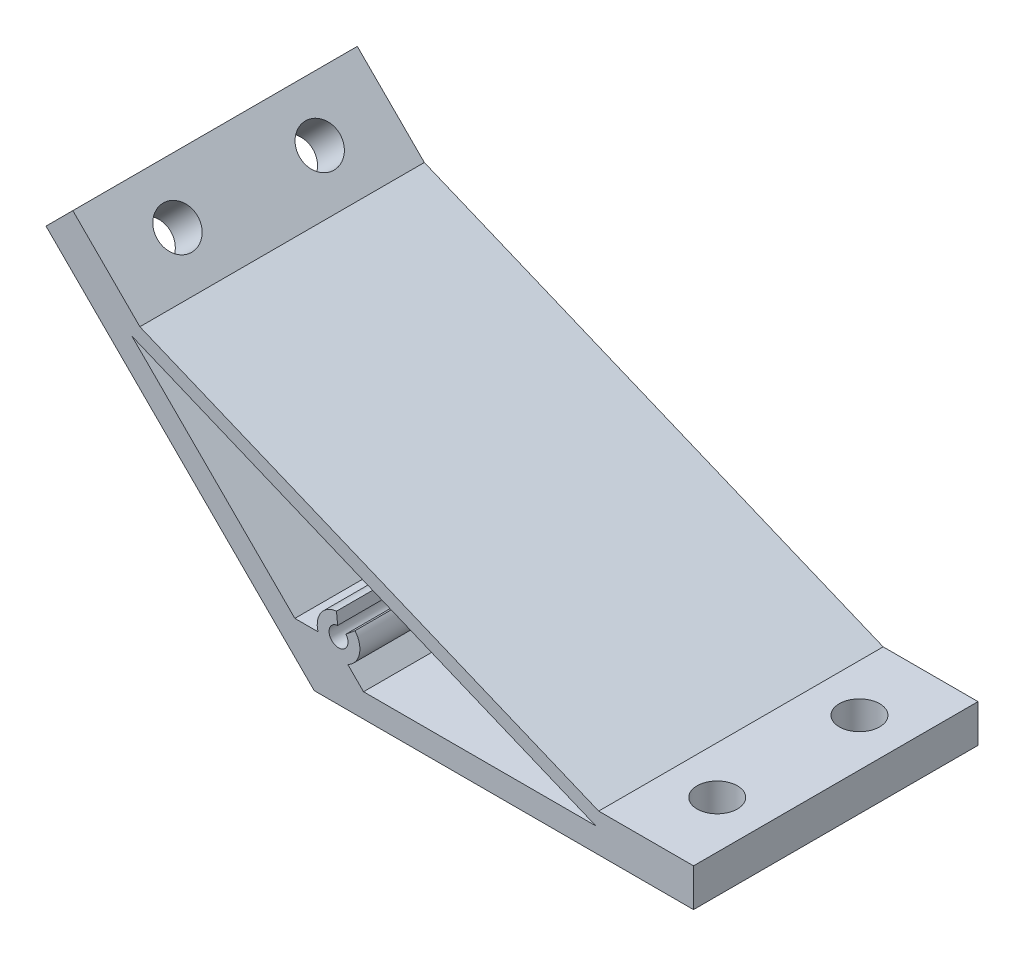
from build123d import *

# Parameters (mm, degrees)
EXTRUDE_1_DEPTH         = 30
HOLE_WIZARD_8_5_8_5_1_D = 8.5
HOLE_WIZARD_8_5_8_5_2_D = 8.5


with BuildPart() as part:
    # 草图1 → 凸台-拉伸1 (new, symmetric)
    with BuildSketch(Plane.XY):
        Polygon((6936.119122288, -1232.086390659), (6992.687664783, -1288.654933154), (7072.687664783, -1288.654933154), (7072.687664783, -1280.654933154), (7052.687664783, -1280.654933154), (6955.918112162, -1240.571672033), (6941.775976538, -1226.429536409), align=None)
        with BuildLine():
            Line((7009.090927681, -1283.654933154), (7003.090927681, -1283.654933154))
            Line((7003.090927681, -1283.654933154), (6999.760549745, -1280.324555218))
            ThreePointArc((6999.760549745, -1280.324555218), (7002.213755914, -1277.239517812), (7001.296666197, -1273.406161221))
            Line((7001.296666197, -1273.406161221), (6999.365595427, -1274.993916141))
            ThreePointArc((6999.365595427, -1274.993916141), (6997.055371947, -1278.111879141), (6997.626530039, -1274.273571671))
            Line((6997.626530039, -1274.273571671), (6997.383769074, -1271.785386165))
            ThreePointArc((6997.383769074, -1271.785386165), (6994.101203016, -1273.731324494), (6993.49338103, -1277.49861375))
            Line((6993.49338103, -1277.49861375), (6988.602413191, -1277.49861375))
            Line((6988.602413191, -1277.49861375), (6954.21874867, -1243.114949228))
            Line((6954.21874867, -1243.114949228), (7052.090927681, -1283.654933154))
            Line((7052.090927681, -1283.654933154), (7029.403393536, -1283.654933154))
            Line((7029.403393536, -1283.654933154), (7009.090927681, -1283.654933154))
        make_face(mode=Mode.SUBTRACT)
    extrude(amount=EXTRUDE_1_DEPTH, both=True)

    # Ø8.5 (8.5) 直径孔1 (through all)
    with Locations(Plane(origin=(2852.016365815, 2852.016365815, 0), x_dir=(0.7071067811865628, -0.7071067811865324, 0), z_dir=(-0.7071067811865324, -0.7071067811865628, 0))):
        with Locations((5785.79350833, -15), (5785.79350833, 15)):
            Hole(HOLE_WIZARD_8_5_8_5_1_D / 2)

    # Ø8.5 (8.5) 直径孔2 (through all)
    with Locations(Plane.XZ.offset(1288.654933154)):
        with Locations((7062.687664783, 15), (7062.687664783, -15)):
            Hole(HOLE_WIZARD_8_5_8_5_2_D / 2)


solid = part.part
